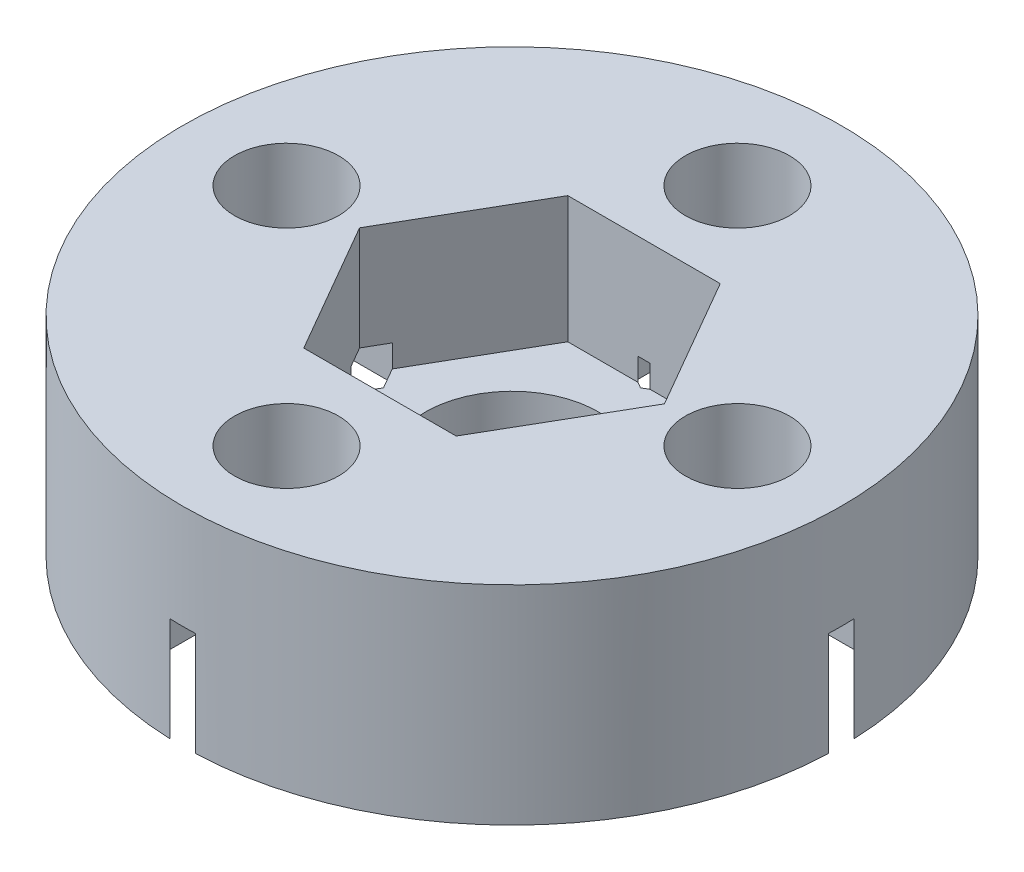
from build123d import *

# Parameters (mm, degrees)
SKETCH2_R           = 9.5
BOSS_EXTRUDE1_DEPTH = 6
CUT_EXTRUDE1_DEPTH  = 3.65
SKETCH4_R           = 2.5
CUT_EXTRUDE2_DEPTH  = 14.92201494
CUT_EXTRUDE4_DEPTH  = 3
SKETCH5_R           = 1.5
CUT_EXTRUDE5_DEPTH  = 15.71393897


with BuildPart() as part:
    # Sketch2 → Boss-Extrude1 (new body)
    with BuildSketch(Plane(origin=(0, 0, 0), x_dir=(1, 0, 0), z_dir=(0, 1, 0))):
        with Locations(Location((0, 0, 0), (0, 0, 270))):
            Circle(SKETCH2_R)
    extrude(amount=BOSS_EXTRUDE1_DEPTH)

    # Sketch3 → Cut-Extrude1 (cut)
    with BuildSketch(Plane(origin=(0, 6, 0), x_dir=(1, 0, 0), z_dir=(0, 1, 0))):
        Polygon((2.1975, -3.80618165), (4.395, 0), (2.1975, 3.80618165), (-2.1975, 3.80618165), (-4.395, 0), (-2.1975, -3.80618165), align=None)
    extrude(amount=-CUT_EXTRUDE1_DEPTH, mode=Mode.SUBTRACT)

    # Sketch4 → Cut-Extrude2 (cut, through all)
    with BuildSketch(Plane(origin=(0, 2.35, 0), x_dir=(1, 0, 0), z_dir=(0, 1, 0))):
        with Locations(Location((0, 0, 0), (0, 0, 270))):
            Circle(SKETCH4_R)
    extrude(amount=-CUT_EXTRUDE2_DEPTH, mode=Mode.SUBTRACT)

    # Sketch6 → Cut-Extrude4 (cut)
    with BuildSketch(Plane.XZ):
        Polygon((-2.598076211, -8.204916605), (0, -9.704916605), (2.598076211, -8.204916605), (2.598076211, -5.204916605), (0, -3.704916605), (-2.598076211, -5.204916605), align=None)
        Polygon((8.204916605, -2.598076211), (9.704916605, 0), (8.204916605, 2.598076211), (5.204916605, 2.598076211), (3.704916605, 0), (5.204916605, -2.598076211), align=None)
        Polygon((-8.204916605, 2.598076211), (-9.704916605, 0), (-8.204916605, -2.598076211), (-5.204916605, -2.598076211), (-3.704916605, 0), (-5.204916605, 2.598076211), align=None)
        Polygon((2.598076211, 8.204916605), (0, 9.704916605), (-2.598076211, 8.204916605), (-2.598076211, 5.204916605), (0, 3.704916605), (2.598076211, 5.204916605), align=None)
    extrude(amount=-CUT_EXTRUDE4_DEPTH, mode=Mode.SUBTRACT)

    # Sketch5 → Cut-Extrude5 (cut, through all)
    with BuildSketch(Plane(origin=(0, 6, 0), x_dir=(1, 0, 0), z_dir=(0, 1, 0))):
        with Locations(Location((6.5, 0, 0), (0, 0, 270))):
            Circle(SKETCH5_R)
        with Locations(Location((0, -6.5, 0), (0, 0, 270))):
            Circle(SKETCH5_R)
        with Locations(Location((-6.5, 0, 0), (0, 0, 270))):
            Circle(SKETCH5_R)
        with Locations(Location((0, 6.5, 0), (0, 0, 270))):
            Circle(SKETCH5_R)
    extrude(amount=-CUT_EXTRUDE5_DEPTH, mode=Mode.SUBTRACT)


solid = part.part
